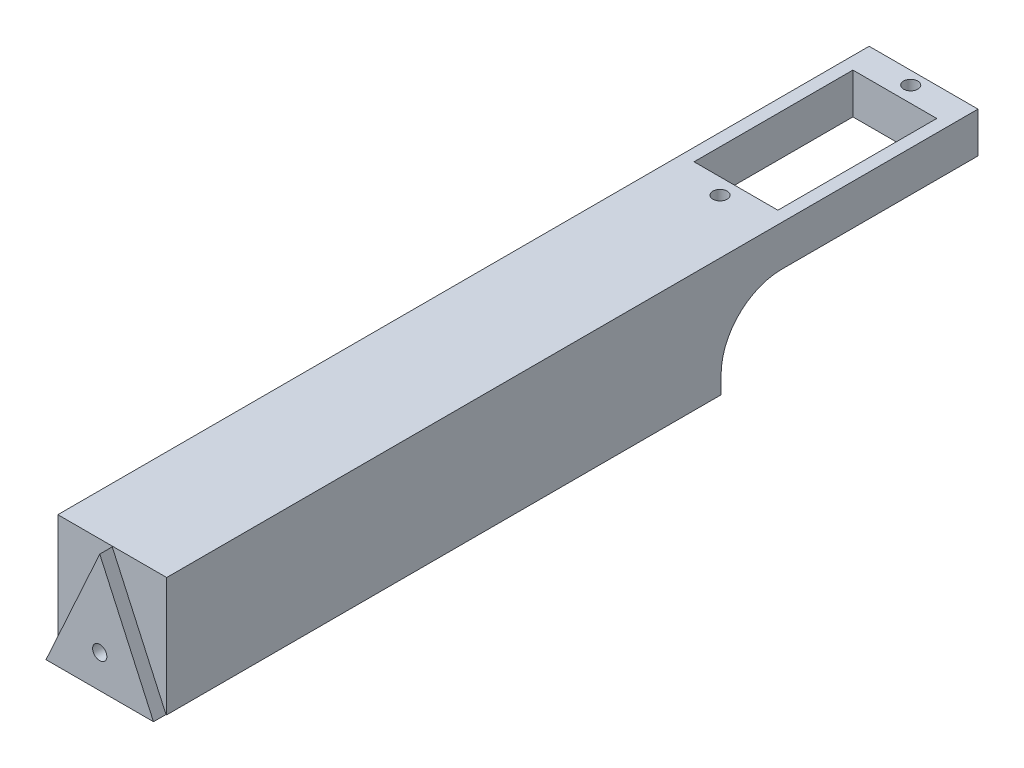
from build123d import *

# Parameters (mm, degrees)
SKIZZE1_W                       = 16.1
SKIZZE1_H                       = 120
AUFSATZ_LINEAR_AUSTRAGEN1_DEPTH = 17.6
AUFSATZ_LINEAR_AUSTRAGEN2_DEPTH = 1.85
SKIZZE3_R                       = 1.05
SCHNITT_LINEAR_AUSTRAGEN1_DEPTH = 13
SKIZZE4_R                       = 1.05
SKIZZE4_W                       = 12.4
SKIZZE4_H                       = 23.5
SCHNITT_LINEAR_AUSTRAGEN2_DEPTH = 65.807291256
SCHNITT_LINEAR_AUSTRAGEN3_DEPTH = 67.29021421


with BuildPart() as part:
    # Skizze1 → Aufsatz-Linear austragen1 (new body)
    with BuildSketch(Plane(origin=(0, 0, 0), x_dir=(1, 0, 0), z_dir=(0, 1, 0))):
        Rectangle(SKIZZE1_W, SKIZZE1_H)
    extrude(amount=AUFSATZ_LINEAR_AUSTRAGEN1_DEPTH)

    # Skizze2 → Aufsatz-Linear austragen2 (add)
    with BuildSketch(Plane.XY.offset(60)):
        Polygon((0, 17.5), (-7.95, 0), (7.95, 0), align=None)
    extrude(amount=AUFSATZ_LINEAR_AUSTRAGEN2_DEPTH)

    # Skizze3 → Schnitt-Linear austragen1 (cut)
    with BuildSketch(Plane.XY.offset(61.85)):
        with Locations((0, 4.89)):
            Circle(SKIZZE3_R)
    extrude(amount=-SCHNITT_LINEAR_AUSTRAGEN1_DEPTH, mode=Mode.SUBTRACT)

    # Skizze4 → Schnitt-Linear austragen2 (cut, through all)
    with BuildSketch(Plane(origin=(0, 17.6, 0), x_dir=(1, 0, 0), z_dir=(0, 1, 0))):
        with Locations(Location((0, 58.1, 0), (0, 0, 270))):
            Circle(SKIZZE4_R)
        with Locations(Location((0, 29.9, 0), (0, 0, 270))):
            Circle(SKIZZE4_R)
        with Locations((0, 44)):
            Rectangle(SKIZZE4_W, SKIZZE4_H)
    extrude(amount=-SCHNITT_LINEAR_AUSTRAGEN2_DEPTH, mode=Mode.SUBTRACT)

    # Skizze5 → Schnitt-Linear austragen3 (cut, through all)
    with BuildSketch(Plane(origin=(8.05, 0, 0), x_dir=(0, 0, -1), z_dir=(1, 0, 0))):
        with BuildLine():
            Line((60, 11.6), (31, 11.6))
            ThreePointArc((31, 11.6), (24.636038969, 8.963961031), (22, 2.6))
            Line((22, 2.6), (22, 0))
            Line((22, 0), (60, 0))
            Line((60, 0), (60, 11.6))
        make_face()
    extrude(amount=-SCHNITT_LINEAR_AUSTRAGEN3_DEPTH, mode=Mode.SUBTRACT)


solid = part.part
